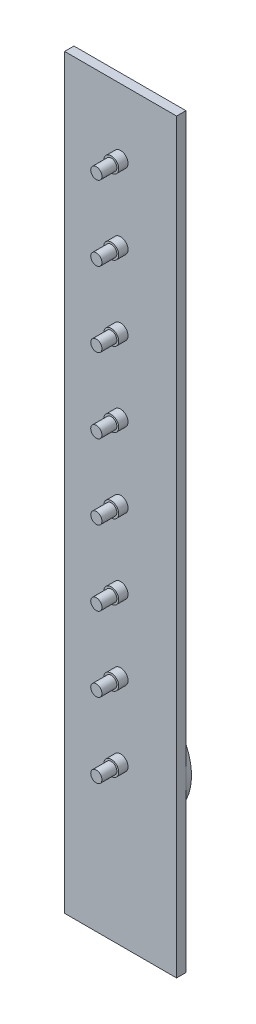
from build123d import *

# Parameters (mm, degrees)
SKETCH1_W           = 60
SKETCH1_H           = 400
BOSS_EXTRUDE1_DEPTH = 5
SKETCH2_R           = 30
BOSS_EXTRUDE2_DEPTH = 3
SKETCH3_R           = 3
BOSS_EXTRUDE3_DEPTH = 13
SKETCH4_R           = 4
BOSS_EXTRUDE4_DEPTH = 5
LPATTERN1_COUNT     = 8
LPATTERN1_PITCH     = 40


with BuildPart() as part:
    # Sketch1 → Boss-Extrude1 (new body)
    with BuildSketch(Plane.XY):
        Rectangle(SKETCH1_W, SKETCH1_H)
    extrude(amount=BOSS_EXTRUDE1_DEPTH)

    # Sketch2 → Boss-Extrude2 (add)
    with BuildSketch(Plane(origin=(0, 0, 0), x_dir=(-1, 0, 0), z_dir=(0, 0, -1))):
        with Locations((0, -110)):
            Circle(SKETCH2_R)
    extrude(amount=BOSS_EXTRUDE2_DEPTH)

    # Sketch3 → Boss-Extrude3 (add)
    with BuildSketch(Plane.XY.offset(5)):
        with Locations(Location((0, 165, 0), (0, 0, 180))):
            Circle(SKETCH3_R)
    boss_extrude3 = extrude(amount=BOSS_EXTRUDE3_DEPTH)

    # Sketch4 → Boss-Extrude4 (add)
    with BuildSketch(Plane.XY.offset(5)):
        with Locations(Location((0, 165, 0), (0, 0, 180))):
            Circle(SKETCH4_R)
    boss_extrude4 = extrude(amount=BOSS_EXTRUDE4_DEPTH)

    # LPattern1: Boss-Extrude3, Boss-Extrude4 ×8
    with Locations(*[(0, -i * LPATTERN1_PITCH, 0) for i in range(1, LPATTERN1_COUNT)]):
        add(boss_extrude3)
        add(boss_extrude4)


solid = part.part
